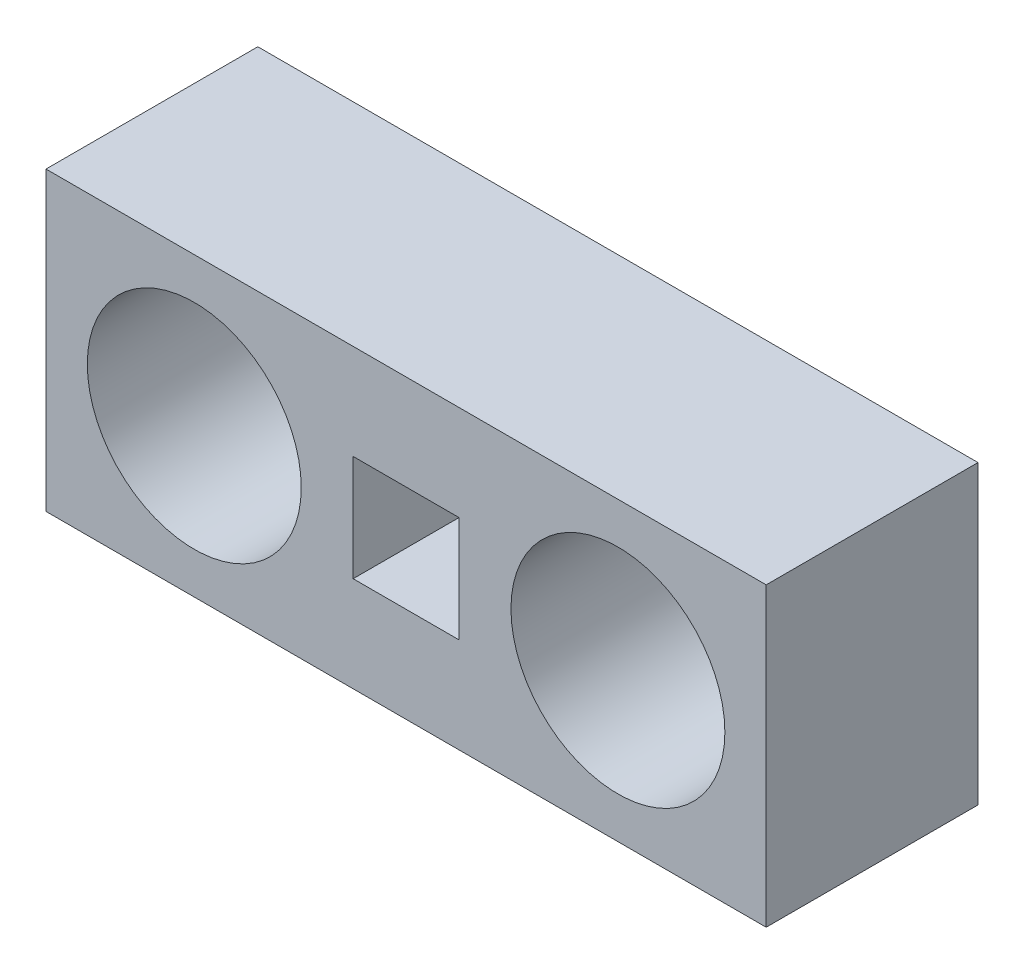
from build123d import *

# Parameters (mm, degrees)
SKETCH_1_W      = 34
SKETCH_1_H      = 14
SKETCH_1_R      = 5.05
SKETCH_1_W_2    = 5
SKETCH_1_H_2    = 5
EXTRUDE_1_DEPTH = 10


with BuildPart() as part:
    # 草图1 → 凸台-拉伸1 (new body)
    with BuildSketch(Plane.XY):
        Rectangle(SKETCH_1_W, SKETCH_1_H)
        with Locations((-10, 0)):
            Circle(SKETCH_1_R, mode=Mode.SUBTRACT)
        with Locations((10, 0)):
            Circle(SKETCH_1_R, mode=Mode.SUBTRACT)
        Rectangle(SKETCH_1_W_2, SKETCH_1_H_2, mode=Mode.SUBTRACT)
    extrude(amount=EXTRUDE_1_DEPTH)


solid = part.part
